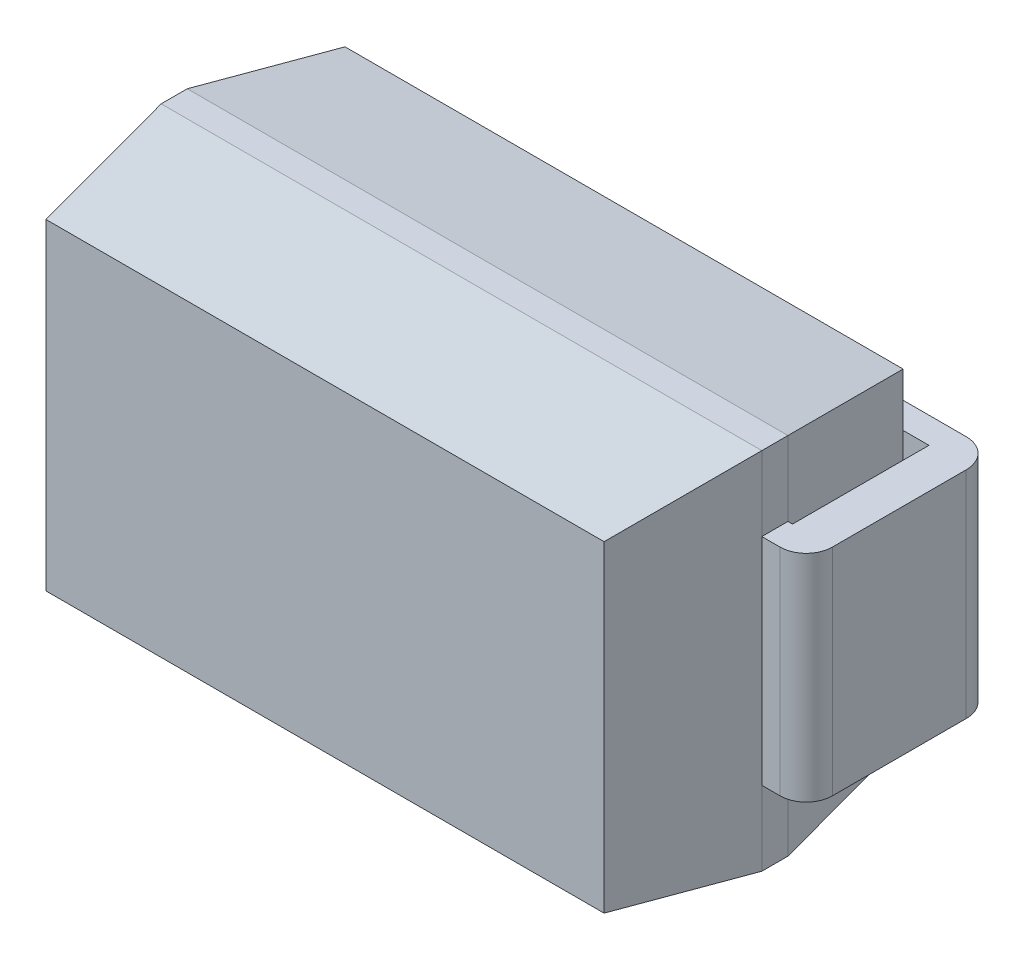
from build123d import *
from OCP.BRepFilletAPI import BRepFilletAPI_MakeChamfer

# Parameters (mm, degrees)
SKETCH_1_W           = 4.6
SKETCH_1_H           = 2.79
EXTRUDE_1_DEPTH      = 2.29
CHAMFER_1_SIZE       = 1.045
CHAMFER_1_SIZE2      = 0.163
CHAMFER_2_SIZE       = 0.163
CHAMFER_2_SIZE2      = 1.045
EXTRUDE_2_DEPTH      = 0.825
EXTRUDE_2_DEPTH_BACK = 0.825


with BuildPart() as part:
    # Эскиз1 → Бобышка-Вытянуть1 (new body)
    with BuildSketch(Plane.XY.offset(0.2)):
        Rectangle(SKETCH_1_W, SKETCH_1_H)
    extrude(amount=EXTRUDE_1_DEPTH)

    # Фаска1: one chamfer whose edges measure the first distance from different faces: ONE call of the kernel's chamfer builder (chamfer() names one face for all edges)
    chamfer_1_edges_1 = [part.edges().sort_by_distance(p)[0] for p in [
        (-2.3, 0, 2.49),
    ]]
    chamfer_1_side_1 = [part.faces().sort_by_distance(p)[0] for p in [
        (-2.3, 0, 1.345),
    ]]
    chamfer_1_edges_2 = [part.edges().sort_by_distance(p)[0] for p in [
        (0, -1.395, 2.49),
    ]]
    chamfer_1_side_2 = [part.faces().sort_by_distance(p)[0] for p in [
        (0, -1.395, 1.345),
    ]]
    chamfer_1_edges_3 = [part.edges().sort_by_distance(p)[0] for p in [
        (2.3, 0, 2.49),
    ]]
    chamfer_1_side_3 = [part.faces().sort_by_distance(p)[0] for p in [
        (2.3, 0, 1.345),
    ]]
    chamfer_1_edges_4 = [part.edges().sort_by_distance(p)[0] for p in [
        (0, 1.395, 2.49),
    ]]
    chamfer_1_side_4 = [part.faces().sort_by_distance(p)[0] for p in [
        (0, 1.395, 1.345),
    ]]
    chamfer_1 = BRepFilletAPI_MakeChamfer(part.part.solid().wrapped)
    for e in chamfer_1_edges_1:
        chamfer_1.Add(CHAMFER_1_SIZE, CHAMFER_1_SIZE2, e.wrapped, chamfer_1_side_1[0].wrapped)  # the first distance lies on this face
    for e in chamfer_1_edges_2:
        chamfer_1.Add(CHAMFER_1_SIZE, CHAMFER_1_SIZE2, e.wrapped, chamfer_1_side_2[0].wrapped)  # the first distance lies on this face
    for e in chamfer_1_edges_3:
        chamfer_1.Add(CHAMFER_1_SIZE, CHAMFER_1_SIZE2, e.wrapped, chamfer_1_side_3[0].wrapped)  # the first distance lies on this face
    for e in chamfer_1_edges_4:
        chamfer_1.Add(CHAMFER_1_SIZE, CHAMFER_1_SIZE2, e.wrapped, chamfer_1_side_4[0].wrapped)  # the first distance lies on this face
    add(Compound.cast(chamfer_1.Shape()), mode=Mode.REPLACE)

    # Фаска2
    chamfer_2_edges = [part.edges().sort_by_distance(p)[0] for p in [
        (0, -1.395, 0.2),
        (-2.3, 0, 0.2),
        (0, 1.395, 0.2),
        (2.3, 0, 0.2),
    ]]
    chamfer_2_side = [part.faces().sort_by_distance(p)[0] for p in [
        (0, 0, 0.2),
    ]]
    chamfer(chamfer_2_edges, length=CHAMFER_2_SIZE, length2=CHAMFER_2_SIZE2, reference=chamfer_2_side[0])


with BuildPart() as body_2:
    # Эскиз2 → Бобышка-Вытянуть2 (new, two sides: drawn at the far end of the back side and taken through both)
    with BuildSketch(Plane(origin=(0, 0, 0), x_dir=(1, 0, 0), z_dir=(0, 1, 0)).offset(-EXTRUDE_2_DEPTH_BACK)):
        with BuildLine():
            Line((-2.335, -0.2), (-2.335, -1.245))
            Line((-2.335, -1.245), (-2.3, -1.245))
            Line((-2.3, -1.245), (-2.3, -1.445))
            Line((-2.3, -1.445), (-2.44, -1.445))
            ThreePointArc((-2.44, -1.445), (-2.581421356, -1.386421356), (-2.64, -1.245))
            Line((-2.64, -1.245), (-2.64, -0.22))
            ThreePointArc((-2.64, -0.22), (-2.575563492, -0.064436508), (-2.42, 0))
            Line((-2.42, 0), (-1.12, 0))
            Line((-1.12, 0), (-1.12, -0.2))
            Line((-1.12, -0.2), (-2.335, -0.2))
        make_face()
    extrude(amount=EXTRUDE_2_DEPTH + EXTRUDE_2_DEPTH_BACK)


with BuildPart() as body_3:
    # Зеркальное отражение1: mirrored copy
    add(body_2.part.mirror(Plane(origin=(0, 0, 0), x_dir=(0, 0, 1), z_dir=(1, 0, 0))))


solid = Compound([part.part, body_2.part, body_3.part])
